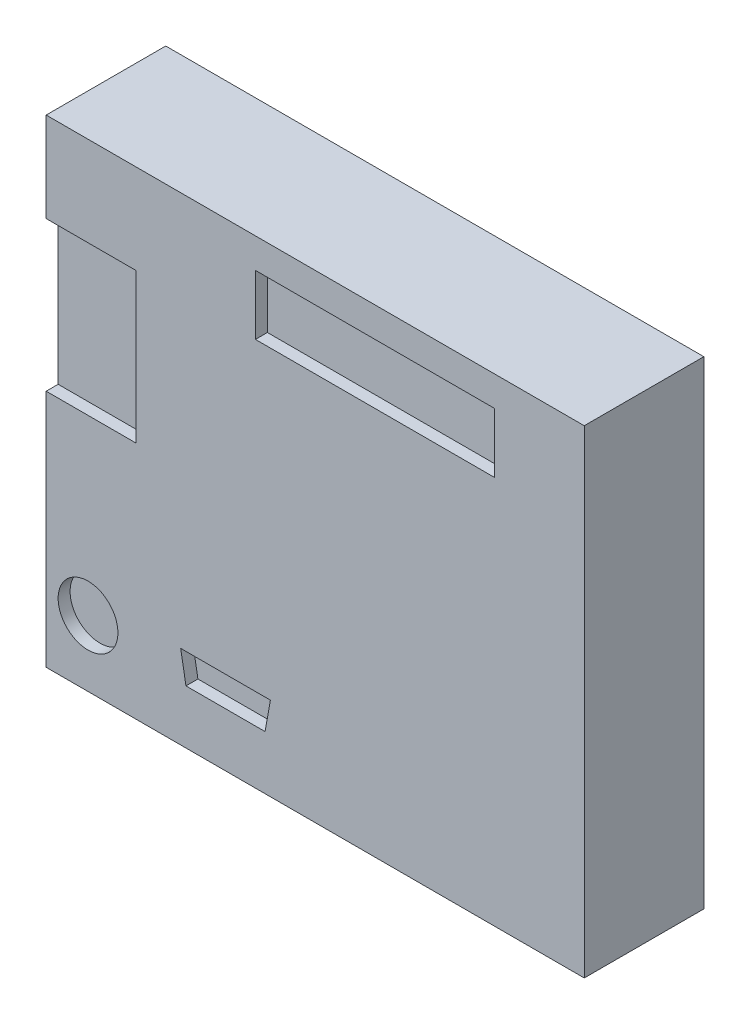
from build123d import *

# Parameters (mm, degrees)
ESQUISSE1_W             = 90
ESQUISSE1_H             = 80
BOSS_EXTRU_1_DEPTH      = 20
ESQUISSE2_W             = 40
ESQUISSE2_H             = 10
ENL_V_MAT_EXTRU_1_DEPTH = 2
ENL_V_MAT_EXTRU_2_DEPTH = 2
ESQUISSE4_R             = 5
ENL_V_MAT_EXTRU_3_DEPTH = 2
ESQUISSE5_W             = 15
ESQUISSE5_H             = 25
ENL_V_MAT_EXTRU_4_DEPTH = 2


with BuildPart() as part:
    # Esquisse1 → Boss.-Extru.1 (new body)
    with BuildSketch(Plane.XY):
        Rectangle(ESQUISSE1_W, ESQUISSE1_H)
    extrude(amount=BOSS_EXTRU_1_DEPTH)

    # Esquisse2 → Enlèv. mat.-Extru.1 (cut)
    with BuildSketch(Plane.XY.offset(20)):
        with Locations((10, 30)):
            Rectangle(ESQUISSE2_W, ESQUISSE2_H)
    extrude(amount=-ENL_V_MAT_EXTRU_1_DEPTH, mode=Mode.SUBTRACT)

    # Esquisse3 → Enlèv. mat.-Extru.2 (cut)
    with BuildSketch(Plane.XY.offset(20)):
        Polygon((-8.381634904, -31), (-21.618365096, -31), (-22.5, -26), (-7.5, -26), align=None)
    extrude(amount=-ENL_V_MAT_EXTRU_2_DEPTH, mode=Mode.SUBTRACT)

    # Esquisse4 → Enlèv. mat.-Extru.3 (cut)
    with BuildSketch(Plane.XY.offset(20)):
        with Locations((-38, -29)):
            Circle(ESQUISSE4_R)
    extrude(amount=-ENL_V_MAT_EXTRU_3_DEPTH, mode=Mode.SUBTRACT)

    # Esquisse5 → Enlèv. mat.-Extru.4 (cut)
    with BuildSketch(Plane.XY.offset(20)):
        with Locations((-37.5, 12.5)):
            Rectangle(ESQUISSE5_W, ESQUISSE5_H)
    extrude(amount=-ENL_V_MAT_EXTRU_4_DEPTH, mode=Mode.SUBTRACT)


solid = part.part
